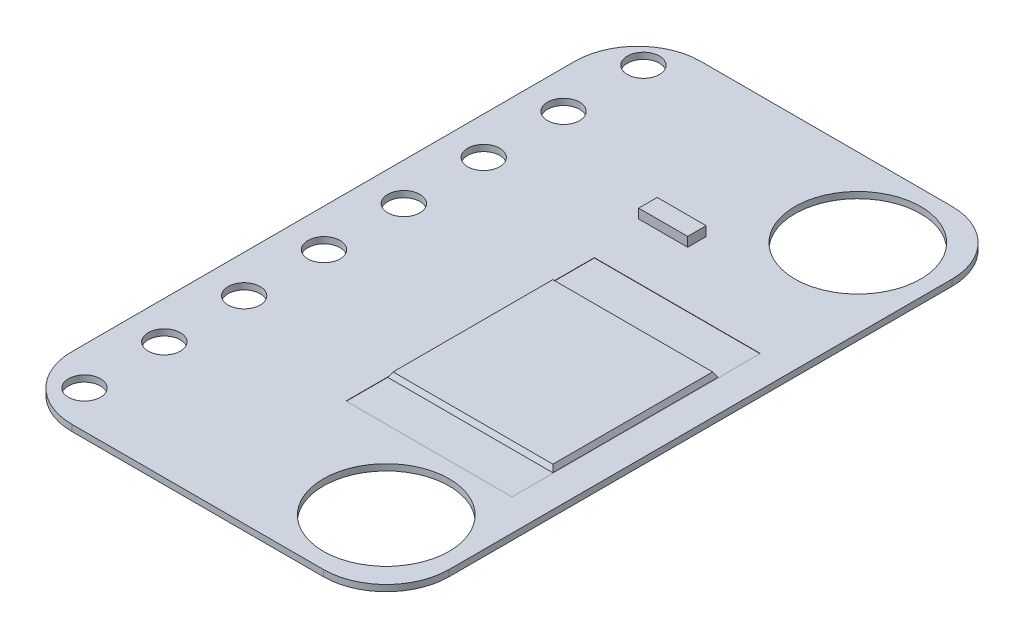
from build123d import *

# Parameters (mm, degrees)
SKETCH1_W           = 12
SKETCH1_H           = 20
BOSS_EXTRUDE1_DEPTH = 0.2
SKETCH3_R           = 0.51
CUT_EXTRUDE1_DEPTH  = 1
SKETCH4_R           = 2
CUT_EXTRUDE2_DEPTH  = 1
SKETCH5_W           = 5.28
SKETCH5_H           = 7.9
CUT_EXTRUDE3_DEPTH  = 0.01
FILLET1_R           = 2
SKETCH6_W           = 1.557265295
SKETCH6_H           = 0.588722246
BOSS_EXTRUDE2_DEPTH = 0.3
SKETCH7_W           = 5.255
SKETCH7_H           = 5.255
BOSS_EXTRUDE3_DEPTH = 0.15
BOSS_EXTRUDE3_TAPER = 30


with BuildPart() as part:
    # Sketch1 → Boss-Extrude1 (new body)
    with BuildSketch(Plane(origin=(0, 0, 0), x_dir=(1, 0, 0), z_dir=(0, 1, 0))):
        Rectangle(SKETCH1_W, SKETCH1_H)
    extrude(amount=BOSS_EXTRUDE1_DEPTH)

    # Sketch3 → Cut-Extrude1 (cut)
    with BuildSketch(Plane(origin=(0, 0.2, 0), x_dir=(1, 0, 0), z_dir=(0, 1, 0))):
        with Locations(Location((-4.8, -8.8, 0), (0, 0, 270))):
            Circle(SKETCH3_R)
        with Locations(Location((-4.8, -6.26, 0), (0, 0, 270))):
            Circle(SKETCH3_R)
        with Locations(Location((-4.8, -3.72, 0), (0, 0, 270))):
            Circle(SKETCH3_R)
        with Locations(Location((-4.8, -1.18, 0), (0, 0, 270))):
            Circle(SKETCH3_R)
        with Locations(Location((-4.8, 1.36, 0), (0, 0, 270))):
            Circle(SKETCH3_R)
        with Locations(Location((-4.8, 3.9, 0), (0, 0, 270))):
            Circle(SKETCH3_R)
        with Locations(Location((-4.8, 6.44, 0), (0, 0, 270))):
            Circle(SKETCH3_R)
        with Locations(Location((-4.8, 8.98, 0), (0, 0, 270))):
            Circle(SKETCH3_R)
    extrude(amount=-CUT_EXTRUDE1_DEPTH, mode=Mode.SUBTRACT)

    # Sketch4 → Cut-Extrude2 (cut)
    with BuildSketch(Plane(origin=(0, 0.2, 0), x_dir=(1, 0, 0), z_dir=(0, 1, 0))):
        with Locations(Location((3.5, 7.5, 0), (0, 0, 270))):
            Circle(SKETCH4_R)
        with Locations(Location((3.5, -7.5, 0), (0, 0, 270))):
            Circle(SKETCH4_R)
    extrude(amount=-CUT_EXTRUDE2_DEPTH, mode=Mode.SUBTRACT)

    # Sketch5 → Cut-Extrude3 (cut)
    with BuildSketch(Plane(origin=(0, 0.2, 0), x_dir=(1, 0, 0), z_dir=(0, 1, 0))):
        with Locations((2.36, -1.05)):
            Rectangle(SKETCH5_W, SKETCH5_H)
    extrude(amount=-CUT_EXTRUDE3_DEPTH, mode=Mode.SUBTRACT)

    # Fillet1
    fillet1_edges = [part.edges().sort_by_distance(p)[0] for p in [
        (6, 0.1, 10),
        (-6, 0.1, 10),
        (-6, 0.1, -10),
        (6, 0.1, -10),
    ]]
    fillet(fillet1_edges, radius=FILLET1_R)

    # Sketch7 → Boss-Extrude3 (add)
    with BuildSketch(Plane(origin=(0, 0.19, 0), x_dir=(1, 0, 0), z_dir=(0, 1, 0))):
        with Locations((2.3475, -1.0475)):
            Rectangle(SKETCH7_W, SKETCH7_H)
    extrude(amount=BOSS_EXTRUDE3_DEPTH, taper=BOSS_EXTRUDE3_TAPER)


with BuildPart() as body_2:
    # Sketch6 → Boss-Extrude2 (new body)
    with BuildSketch(Plane(origin=(0, 0.2, 0), x_dir=(1, 0, 0), z_dir=(0, 1, 0))):
        with Locations((0.139479445, 4.964058352)):
            Rectangle(SKETCH6_W, SKETCH6_H)
    extrude(amount=BOSS_EXTRUDE2_DEPTH)


solid = Compound([part.part, body_2.part])
